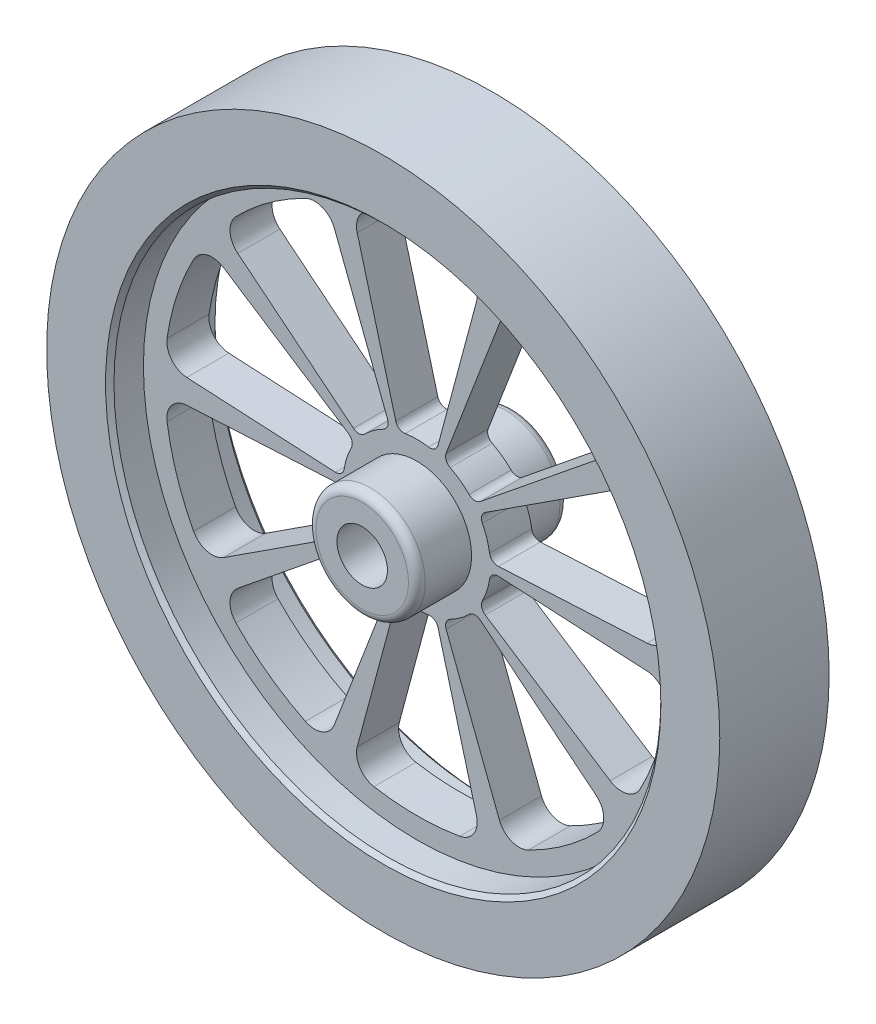
from build123d import *

# Parameters (mm, degrees)
SKETCH1_R               = 80
SKETCH1_R_2             = 6
BOSS_EXTRUDE1_DEPTH     = 5
SKETCH3_R               = 80
SKETCH3_R_2             = 65
SKETCH3_R_3             = 13
SKETCH3_R_4             = 6
BOSS_EXTRUDE2_DEPTH     = 13
SKETCH5_R               = 13
SKETCH5_R_2             = 6
BOSS_EXTRUDE3_DEPTH     = 18
CUT_EXTRUDE1_REACH      = 116.56
CUT_EXTRUDE1_END_RADIUS = 13
SKETCH6_R               = 2.5
CHAMFER1_SIZE           = 1
FILLET1_R               = 2


with BuildPart() as part:
    # Sketch1 → Boss-Extrude1 (new, symmetric)
    with BuildSketch(Plane.XY):
        Circle(SKETCH1_R)
        Circle(SKETCH1_R_2, mode=Mode.SUBTRACT)
        with BuildLine():
            Line((14.176102931, 52.905936394), (5.020355656, 18.73622238))
            ThreePointArc((5.020355656, 18.73622238), (4.176125187, 17.575444503), (2.771734362, 17.279105551))
            ThreePointArc((2.771734362, 17.279105551), (0, 17.5), (-2.771734362, 17.279105551))
            ThreePointArc((-2.771734362, 17.279105551), (-4.176125187, 17.575444503), (-5.020355656, 18.73622238))
            Line((-5.020355656, 18.73622238), (-14.176102931, 52.905936394))
            ThreePointArc((-14.176102931, 52.905936394), (-13.558361761, 56.8944703), (-10.196153236, 59.127307221))
            ThreePointArc((-10.196153236, 59.127307221), (0, 60), (10.196153236, 59.127307221))
            ThreePointArc((10.196153236, 59.127307221), (13.558361761, 56.8944703), (14.176102931, 52.905936394))
        make_face(mode=Mode.SUBTRACT)
        with BuildLine():
            Line((19.628620985, 51.134305884), (6.951322155, 18.108813332))
            ThreePointArc((6.951322155, 18.108813332), (6.952030834, 16.673498083), (7.914023213, 15.608274619))
            ThreePointArc((7.914023213, 15.608274619), (10.286241915, 14.157797402), (12.398783618, 12.349905457))
            ThreePointArc((12.398783618, 12.349905457), (13.709143329, 11.76416849), (15.074428242, 12.2070313))
            Line((15.074428242, 12.2070313), (42.566037356, 34.469297408))
            ThreePointArc((42.566037356, 34.469297408), (44.41067566, 38.05918827), (43.003020438, 41.841847871))
            ThreePointArc((43.003020438, 41.841847871), (35.267115138, 48.541019662), (26.505297947, 53.828144876))
            ThreePointArc((26.505297947, 53.828144876), (22.472785499, 53.997998447), (19.628620985, 51.134305884))
        make_face(mode=Mode.SUBTRACT)
        with BuildLine():
            Line((45.935878838, 29.831108518), (16.26783117, 10.564453087))
            ThreePointArc((16.26783117, 10.564453087), (15.424747368, 9.402842107), (15.576892908, 7.975613289))
            ThreePointArc((15.576892908, 7.975613289), (16.643489035, 5.407797402), (17.289918951, 2.703461236))
            ThreePointArc((17.289918951, 2.703461236), (18.005734675, 1.459379963), (19.370581601, 1.015169165))
            Line((19.370581601, 1.015169165), (54.697192278, 2.86655838))
            ThreePointArc((54.697192278, 2.86655838), (58.29962092, 4.686589906), (59.384195451, 8.574224786))
            ThreePointArc((59.384195451, 8.574224786), (57.063390978, 18.541019662), (53.082626196, 27.968460739))
            ThreePointArc((53.082626196, 27.968460739), (49.92009252, 30.476126512), (45.935878838, 29.831108518))
        make_face(mode=Mode.SUBTRACT)
        with BuildLine():
            Line((54.697192278, -2.86655838), (19.370581601, -1.015169165))
            ThreePointArc((19.370581601, -1.015169165), (18.005734675, -1.459379963), (17.289918951, -2.703461236))
            ThreePointArc((17.289918951, -2.703461236), (16.643489035, -5.407797402), (15.576892908, -7.975613289))
            ThreePointArc((15.576892908, -7.975613289), (15.424747368, -9.402842107), (16.26783117, -10.564453087))
            Line((16.26783117, -10.564453087), (45.935878838, -29.831108518))
            ThreePointArc((45.935878838, -29.831108518), (49.92009252, -30.476126512), (53.082626196, -27.968460739))
            ThreePointArc((53.082626196, -27.968460739), (57.063390978, -18.541019662), (59.384195451, -8.574224786))
            ThreePointArc((59.384195451, -8.574224786), (58.29962092, -4.686589906), (54.697192278, -2.86655838))
        make_face(mode=Mode.SUBTRACT)
        with BuildLine():
            Line((42.566037356, -34.469297408), (15.074428242, -12.2070313))
            ThreePointArc((15.074428242, -12.2070313), (13.709143329, -11.76416849), (12.398783618, -12.349905457))
            ThreePointArc((12.398783618, -12.349905457), (10.286241915, -14.157797402), (7.914023213, -15.608274619))
            ThreePointArc((7.914023213, -15.608274619), (6.952030834, -16.673498083), (6.951322155, -18.108813332))
            Line((6.951322155, -18.108813332), (19.628620985, -51.134305884))
            ThreePointArc((19.628620985, -51.134305884), (22.472785499, -53.997998447), (26.505297947, -53.828144876))
            ThreePointArc((26.505297947, -53.828144876), (35.267115138, -48.541019662), (43.003020438, -41.841847871))
            ThreePointArc((43.003020438, -41.841847871), (44.41067566, -38.05918827), (42.566037356, -34.469297408))
        make_face(mode=Mode.SUBTRACT)
        with BuildLine():
            Line((14.176102931, -52.905936394), (5.020355656, -18.73622238))
            ThreePointArc((5.020355656, -18.73622238), (4.176125187, -17.575444503), (2.771734362, -17.279105551))
            ThreePointArc((2.771734362, -17.279105551), (0, -17.5), (-2.771734362, -17.279105551))
            ThreePointArc((-2.771734362, -17.279105551), (-4.176125187, -17.575444503), (-5.020355656, -18.73622238))
            Line((-5.020355656, -18.73622238), (-14.176102931, -52.905936394))
            ThreePointArc((-14.176102931, -52.905936394), (-13.558361761, -56.8944703), (-10.196153236, -59.127307221))
            ThreePointArc((-10.196153236, -59.127307221), (0, -60), (10.196153236, -59.127307221))
            ThreePointArc((10.196153236, -59.127307221), (13.558361761, -56.8944703), (14.176102931, -52.905936394))
        make_face(mode=Mode.SUBTRACT)
        with BuildLine():
            Line((-19.628620985, -51.134305884), (-6.951322155, -18.108813332))
            ThreePointArc((-6.951322155, -18.108813332), (-6.952030834, -16.673498083), (-7.914023213, -15.608274619))
            ThreePointArc((-7.914023213, -15.608274619), (-10.286241915, -14.157797402), (-12.398783618, -12.349905457))
            ThreePointArc((-12.398783618, -12.349905457), (-13.709143329, -11.76416849), (-15.074428242, -12.2070313))
            Line((-15.074428242, -12.2070313), (-42.566037356, -34.469297408))
            ThreePointArc((-42.566037356, -34.469297408), (-44.41067566, -38.05918827), (-43.003020438, -41.841847871))
            ThreePointArc((-43.003020438, -41.841847871), (-35.267115138, -48.541019662), (-26.505297947, -53.828144876))
            ThreePointArc((-26.505297947, -53.828144876), (-22.472785499, -53.997998447), (-19.628620985, -51.134305884))
        make_face(mode=Mode.SUBTRACT)
        with BuildLine():
            Line((-45.935878838, -29.831108518), (-16.26783117, -10.564453087))
            ThreePointArc((-16.26783117, -10.564453087), (-15.424747368, -9.402842107), (-15.576892908, -7.975613289))
            ThreePointArc((-15.576892908, -7.975613289), (-16.643489035, -5.407797402), (-17.289918951, -2.703461236))
            ThreePointArc((-17.289918951, -2.703461236), (-18.005734675, -1.459379963), (-19.370581601, -1.015169165))
            Line((-19.370581601, -1.015169165), (-54.697192278, -2.86655838))
            ThreePointArc((-54.697192278, -2.86655838), (-58.29962092, -4.686589906), (-59.384195451, -8.574224786))
            ThreePointArc((-59.384195451, -8.574224786), (-57.063390978, -18.541019662), (-53.082626196, -27.968460739))
            ThreePointArc((-53.082626196, -27.968460739), (-49.92009252, -30.476126512), (-45.935878838, -29.831108518))
        make_face(mode=Mode.SUBTRACT)
        with BuildLine():
            Line((-54.697192278, 2.86655838), (-19.370581601, 1.015169165))
            ThreePointArc((-19.370581601, 1.015169165), (-18.005734675, 1.459379963), (-17.289918951, 2.703461236))
            ThreePointArc((-17.289918951, 2.703461236), (-16.643489035, 5.407797402), (-15.576892908, 7.975613289))
            ThreePointArc((-15.576892908, 7.975613289), (-15.424747368, 9.402842107), (-16.26783117, 10.564453087))
            Line((-16.26783117, 10.564453087), (-45.935878838, 29.831108518))
            ThreePointArc((-45.935878838, 29.831108518), (-49.92009252, 30.476126512), (-53.082626196, 27.968460739))
            ThreePointArc((-53.082626196, 27.968460739), (-57.063390978, 18.541019662), (-59.384195451, 8.574224786))
            ThreePointArc((-59.384195451, 8.574224786), (-58.29962092, 4.686589906), (-54.697192278, 2.86655838))
        make_face(mode=Mode.SUBTRACT)
        with BuildLine():
            Line((-42.566037356, 34.469297408), (-15.074428242, 12.2070313))
            ThreePointArc((-15.074428242, 12.2070313), (-13.709143329, 11.76416849), (-12.398783618, 12.349905457))
            ThreePointArc((-12.398783618, 12.349905457), (-10.286241915, 14.157797402), (-7.914023213, 15.608274619))
            ThreePointArc((-7.914023213, 15.608274619), (-6.952030834, 16.673498083), (-6.951322155, 18.108813332))
            Line((-6.951322155, 18.108813332), (-19.628620985, 51.134305884))
            ThreePointArc((-19.628620985, 51.134305884), (-22.472785499, 53.997998447), (-26.505297947, 53.828144876))
            ThreePointArc((-26.505297947, 53.828144876), (-35.267115138, 48.541019662), (-43.003020438, 41.841847871))
            ThreePointArc((-43.003020438, 41.841847871), (-44.41067566, 38.05918827), (-42.566037356, 34.469297408))
        make_face(mode=Mode.SUBTRACT)
    extrude(amount=BOSS_EXTRUDE1_DEPTH, both=True)

    # Sketch3 → Boss-Extrude2 (add, symmetric)
    # profile 1 of 2: a face of its own
    with BuildSketch(Plane.XY):
        Circle(SKETCH3_R)
        with Locations(Location((0, 0, 0), (0, 0, 180))):
            Circle(SKETCH3_R_2, mode=Mode.SUBTRACT)
    # profile 2 of 2: a face of its own
    with BuildSketch(Plane.XY):
        with Locations(Location((0, 0, 0), (0, 0, 180))):
            Circle(SKETCH3_R_3)
        Circle(SKETCH3_R_4, mode=Mode.SUBTRACT)
    extrude(amount=BOSS_EXTRUDE2_DEPTH, both=True)

    # Sketch5 → Boss-Extrude3 (add, symmetric)
    with BuildSketch(Plane.XY):
        with Locations(Location((0, 0, 0), (0, 0, 180))):
            Circle(SKETCH5_R)
        Circle(SKETCH5_R_2, mode=Mode.SUBTRACT)
    extrude(amount=BOSS_EXTRUDE3_DEPTH, both=True)

    # Cut-Extrude1: up to this cylinder (the profile starts inside it)
    cut_extrude1_end = Plane(origin=(0, 0, -13), z_dir=(0, 0, -1)) * Cylinder(CUT_EXTRUDE1_END_RADIUS, 260.12, mode=Mode.PRIVATE)
    # Sketch6 → Cut-Extrude1 (cut, up to the surface)
    with BuildSketch(Plane(origin=(0, 0, 0), x_dir=(1, 0, 0), z_dir=(0, 1, 0)), mode=Mode.PRIVATE) as cut_extrude1_sk1:
        with Locations(Location((0, 13, 0), (0, 0, 270))):
            Circle(SKETCH6_R)
    cut_extrude1_tool1 = extrude(cut_extrude1_sk1.sketch, amount=-CUT_EXTRUDE1_REACH, mode=Mode.PRIVATE) & cut_extrude1_end
    add(cut_extrude1_tool1.solids().sort_by_distance((0, 0, -13))[0], mode=Mode.SUBTRACT)

    # Chamfer1
    chamfer1_edges = [part.edges().sort_by_distance(p)[0] for p in [
        (65, 0, 13),
        (65, 0, -13),
    ]]
    chamfer(chamfer1_edges, length=CHAMFER1_SIZE)

    # Fillet1
    fillet1_edges = [part.edges().sort_by_distance(p)[0] for p in [
        (13, 0, -18),
        (13, 0, 18),
    ]]
    fillet(fillet1_edges, radius=FILLET1_R)


solid = part.part
